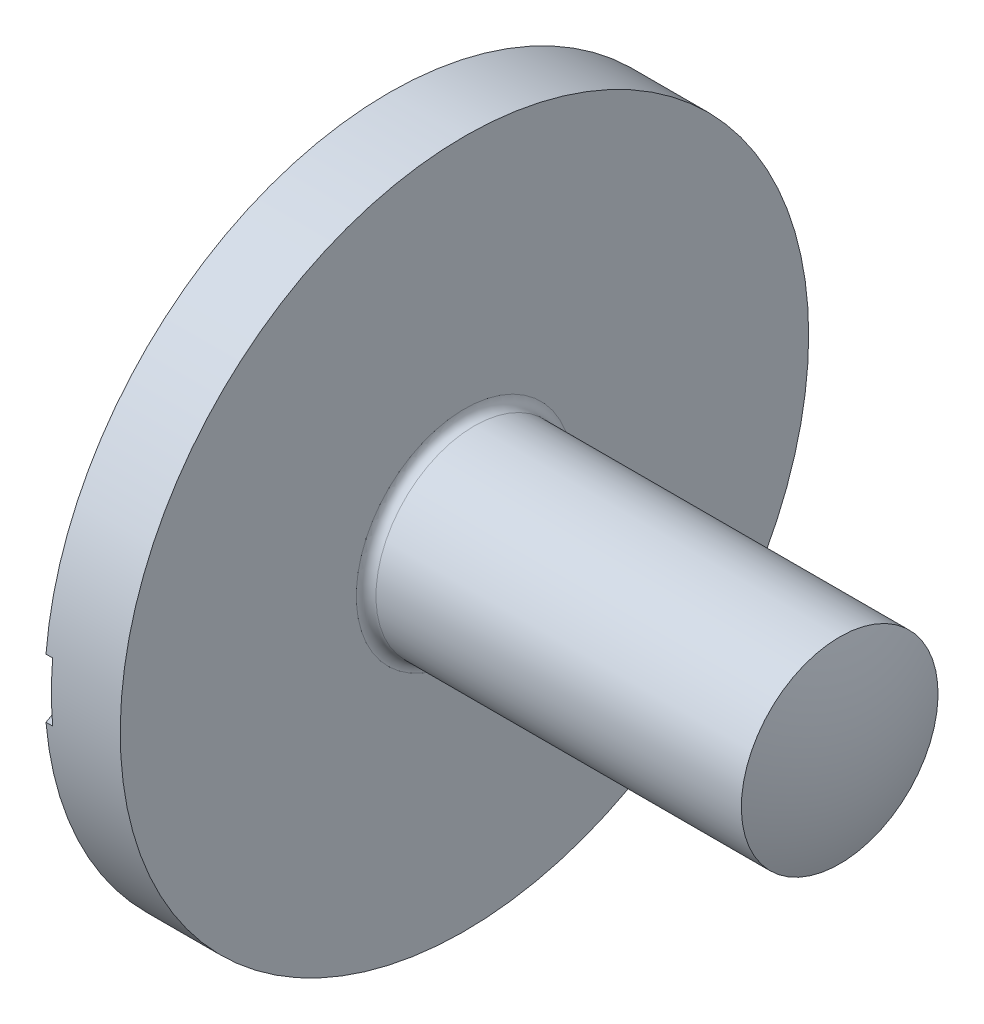
from build123d import *

# Parameters (mm, degrees)
SKETCH1_R       = 7
BASEHEAD_DEPTH  = 2.8
SKETCH2_R       = 2
BASEBODY_DEPTH  = 8
SLOT_DEPTH      = 15.650597257
SLOT_DEPTH_BACK = 15.650597257
SKETCH3_W       = 1.4
SKETCH3_H       = 1.2
HEADFILLET_R    = 0.2


with BuildPart() as part:
    # Sketch1 → BaseHead (new body)
    with BuildSketch(Plane(origin=(0, 0, 0), x_dir=(0, 0, -1), z_dir=(1, 0, 0))):
        Circle(SKETCH1_R)
    extrude(amount=BASEHEAD_DEPTH)

    # Sketch2 → BaseBody (add)
    with BuildSketch(Plane(origin=(2.8, 0.067556317, 0.30150137), x_dir=(0, 0, -1), z_dir=(1, 0, 0))):
        with Locations((0.30150137, -0.067556317)):
            Circle(SKETCH2_R)
    extrude(amount=BASEBODY_DEPTH)

    # Sketch3 → Slot (cut, two sides: drawn at the far end of the back side and taken through both)
    with BuildSketch(Plane.XY.offset(-SLOT_DEPTH_BACK)):
        with Locations((0.7, 0)):
            Rectangle(SKETCH3_W, SKETCH3_H)
    extrude(amount=SLOT_DEPTH + SLOT_DEPTH_BACK, mode=Mode.SUBTRACT)

    # Sketch4 → BaseTop (revolve, cut)
    with BuildSketch(Plane(origin=(-5.763764327, 3.913764327, 0), x_dir=(0, -1, 0), z_dir=(0, 0, 1))):
        with BuildLine():
            Line((1.913764327, 18.563764327), (1.913764327, 16.194443059))
            ThreePointArc((1.913764327, 16.194443059), (2.896857473, 16.470660045), (3.913764327, 16.563764327))
            Line((3.913764327, 16.563764327), (3.913764327, 18.563764327))
            Line((3.913764327, 18.563764327), (1.913764327, 18.563764327))
        make_face()
        with BuildLine():
            Line((-3.086235673, 3.763764327), (3.913764327, 3.763764327))
            Line((3.913764327, 3.763764327), (3.913764327, 5.763764327))
            ThreePointArc((3.913764327, 5.763764327), (0.357072037, 6.08255654), (-3.086235673, 7.028770332))
            Line((-3.086235673, 7.028770332), (-3.086235673, 3.763764327))
        make_face()
    revolve(axis=Axis((9.335097479, 0, 0), (-1, 0, 0)), mode=Mode.SUBTRACT)

    # HeadFillet
    headfillet_edges = [part.edges().sort_by_distance(p)[0] for p in [
        (2.8, 0, 2),
    ]]
    fillet(headfillet_edges, radius=HEADFILLET_R)


solid = part.part
